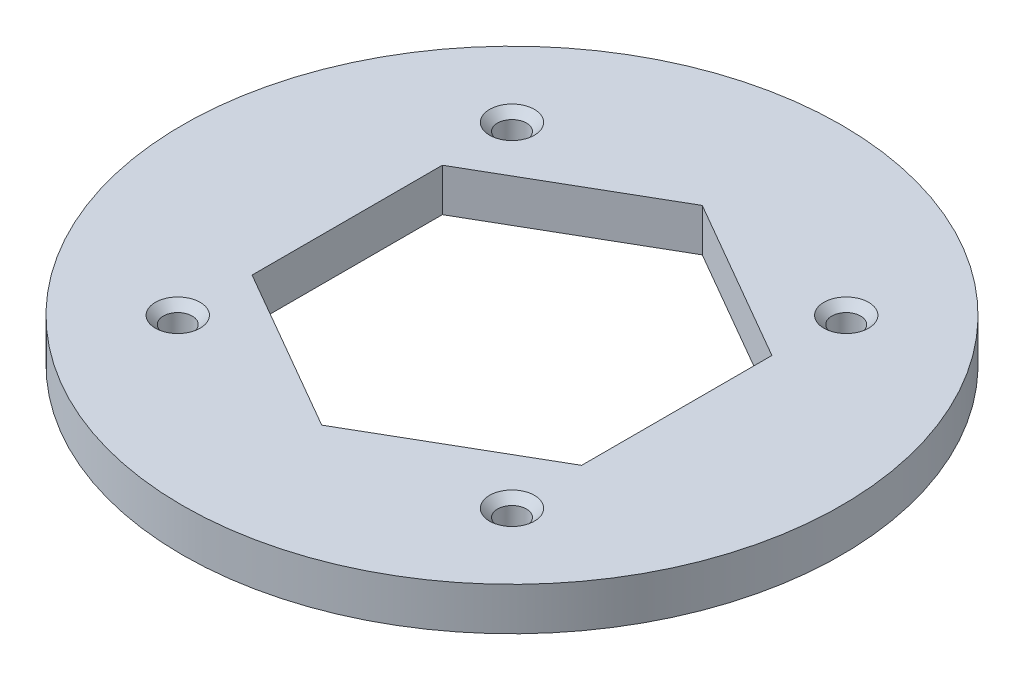
from build123d import *

# Parameters (mm, degrees)
SKETCH1_R           = 50
SKETCH1_R_2         = 2.2
BOSS_EXTRUDE1_DEPTH = 6.5
SKETCH1_3_R         = 50
SKETCH1_3_R_2       = 2.2
BOSS_EXTRUDE2_DEPTH = 2
SKETCH2_R           = 5.5
CUT_EXTRUDE1_DEPTH  = 2.5
CUT_EXTRUDE2_DEPTH  = 10
CHAMFER1_SIZE       = 1.2


with BuildPart() as part:
    # Sketch1 → Boss-Extrude1 (new body)
    with BuildSketch(Plane(origin=(0, 0, 0), x_dir=(1, 0, 0), z_dir=(0, 1, 0))):
        Circle(SKETCH1_R)
        with Locations((-25.355339059, -25.355339059)):
            Circle(SKETCH1_R_2, mode=Mode.SUBTRACT)
        with Locations((25.355339059, -25.355339059)):
            Circle(SKETCH1_R_2, mode=Mode.SUBTRACT)
        with Locations((-25.355339059, 25.355339059)):
            Circle(SKETCH1_R_2, mode=Mode.SUBTRACT)
        with Locations((25.355339059, 25.355339059)):
            Circle(SKETCH1_R_2, mode=Mode.SUBTRACT)
    extrude(amount=BOSS_EXTRUDE1_DEPTH)

    # Sketch1<3> → Boss-Extrude2 (add)
    with BuildSketch(Plane(origin=(0, 0, 0), x_dir=(1, 0, 0), z_dir=(0, 1, 0))):
        Circle(SKETCH1_3_R)
        with Locations((-25.355339059, -25.355339059)):
            Circle(SKETCH1_3_R_2, mode=Mode.SUBTRACT)
        with Locations((25.355339059, -25.355339059)):
            Circle(SKETCH1_3_R_2, mode=Mode.SUBTRACT)
        with Locations((-25.355339059, 25.355339059)):
            Circle(SKETCH1_3_R_2, mode=Mode.SUBTRACT)
        with Locations((25.355339059, 25.355339059)):
            Circle(SKETCH1_3_R_2, mode=Mode.SUBTRACT)
    extrude(amount=BOSS_EXTRUDE2_DEPTH)

    # Sketch2 → Cut-Extrude1 (cut)
    with BuildSketch(Plane.XZ):
        with Locations((0, 35.355339059)):
            Circle(SKETCH2_R)
    extrude(amount=-CUT_EXTRUDE1_DEPTH, mode=Mode.SUBTRACT)

    # Sketch3 → Cut-Extrude2 (cut)
    with BuildSketch(Plane(origin=(0, 6.5, 0), x_dir=(1, 0, 0), z_dir=(0, 1, 0))):
        Polygon((0, 28.867513459), (-25, 14.43375673), (-25, -14.43375673), (0, -28.867513459), (25, -14.43375673), (25, 14.43375673), align=None)
    extrude(amount=-CUT_EXTRUDE2_DEPTH, mode=Mode.SUBTRACT)

    # Chamfer1
    chamfer1_edges = [part.edges().sort_by_distance(p)[0] for p in [
        (23.155339059, 6.5, -25.355339059),
        (-27.555339059, 6.5, -25.355339059),
        (-27.555339059, 6.5, 25.355339059),
        (23.155339059, 6.5, 25.355339059),
    ]]
    chamfer(chamfer1_edges, length=CHAMFER1_SIZE)


solid = part.part
